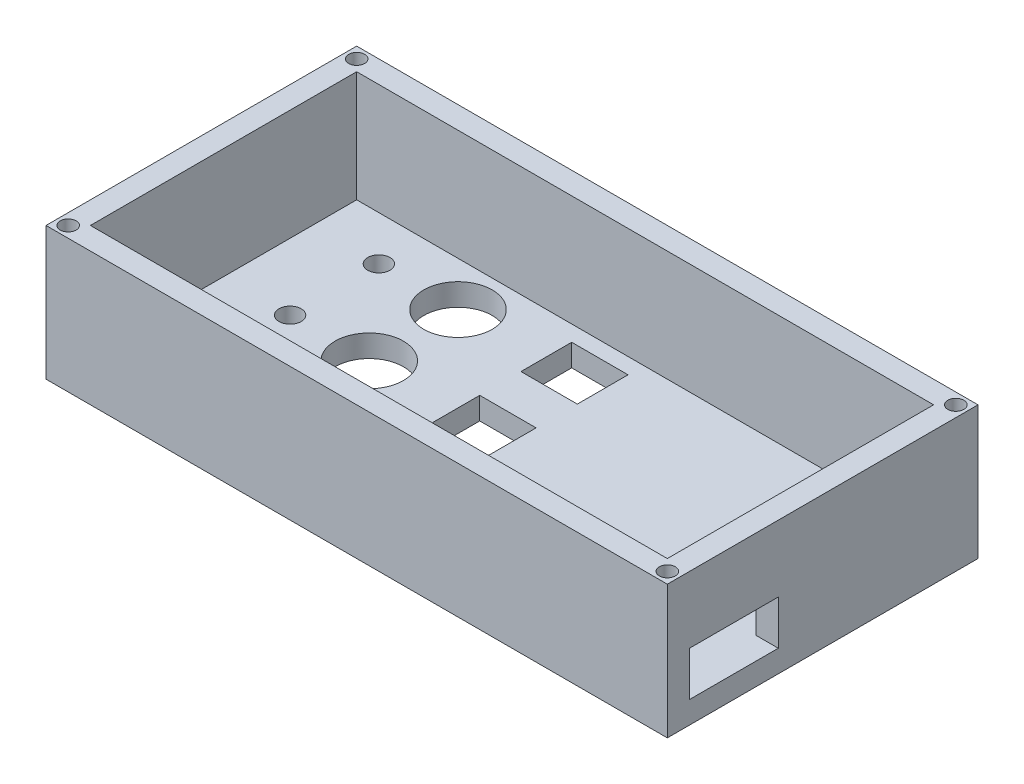
from build123d import *

# Parameters (mm, degrees)
SKETCH1_W                = 140
SKETCH1_H                = 70
BOSS_EXTRUDE1_DEPTH      = 30
SKETCH2_W                = 130
SKETCH2_H                = 60
CUT_EXTRUDE1_DEPTH       = 25
SKETCH3_W                = 5
SKETCH3_H                = 5.715
CUT_EXTRUDE2_DEPTH       = 25
SKETCH4_W                = 20
SKETCH4_H                = 10
CUT_EXTRUDE6_DEPTH       = 25
M3_CLEARANCE_HOLE1_D     = 3.6
M3_CLEARANCE_HOLE1_DEPTH = 5
M3_CLEARANCE_HOLE1_TIP   = 1.081549114


with BuildPart() as part:
    # Sketch1 → Boss-Extrude1 (new body)
    with BuildSketch(Plane(origin=(0, 0, 0), x_dir=(1, 0, 0), z_dir=(0, 1, 0))):
        with Locations((70, 35)):
            Rectangle(SKETCH1_W, SKETCH1_H)
    extrude(amount=BOSS_EXTRUDE1_DEPTH)

    # Sketch2 → Cut-Extrude1 (cut)
    with BuildSketch(Plane(origin=(0, 30, 0), x_dir=(1, 0, 0), z_dir=(0, 1, 0))):
        with Locations((70, 35)):
            Rectangle(SKETCH2_W, SKETCH2_H)
    extrude(amount=-CUT_EXTRUDE1_DEPTH, mode=Mode.SUBTRACT)

    # Sketch3 → Cut-Extrude2 (cut)
    with BuildSketch(Plane.XZ):
        with BuildLine():
            ThreePointArc((22.5, -15), (21.767766953, -13.232233047), (20, -12.5))
            Line((20, -12.5), (20, -15))
            Line((20, -15), (20, -17.5))
            ThreePointArc((20, -17.5), (21.767766953, -16.767766953), (22.5, -15))
        make_face()
        with BuildLine():
            ThreePointArc((45.533822472, -15), (32.389100257, -9.555277785), (37.833822472, -22.7))
            ThreePointArc((37.833822472, -22.7), (43.278544687, -20.444722215), (45.533822472, -15))
        make_face()
        Polygon((57.017644944, -20), (62.017644944, -20), (69.717644944, -20), (69.717644944, -8.57), (57.017644944, -8.57), (57.017644944, -15), align=None)
        Polygon((69.717644944, -50), (62.017644944, -50), (57.017644944, -50), (57.017644944, -61.43), (69.717644944, -61.43), align=None)
        with Locations((59.517644944, -32.1425)):
            Rectangle(SKETCH3_W, SKETCH3_H)
        with Locations((59.517644944, -37.8575)):
            Rectangle(SKETCH3_W, SKETCH3_H)
        with BuildLine():
            ThreePointArc((45.533822472, -55), (43.278544687, -49.555277785), (37.833822472, -47.3))
            ThreePointArc((37.833822472, -47.3), (32.389100257, -60.444722215), (45.533822472, -55))
        make_face()
        with BuildLine():
            ThreePointArc((37.833822472, -27.3), (32.389100257, -29.555277785), (30.133822472, -35))
            Line((30.133822472, -35), (37.833822472, -35))
            Line((37.833822472, -35), (37.833822472, -27.3))
        make_face()
        with BuildLine():
            Line((37.833822472, -35), (30.133822472, -35))
            ThreePointArc((30.133822472, -35), (32.389100257, -40.444722215), (37.833822472, -42.7))
            Line((37.833822472, -42.7), (37.833822472, -35))
        make_face()
        with BuildLine():
            ThreePointArc((22.5, -55), (21.767766953, -53.232233047), (20, -52.5))
            Line((20, -52.5), (20, -57.5))
            ThreePointArc((20, -57.5), (21.767766953, -56.767766953), (22.5, -55))
        make_face()
        with BuildLine():
            Line((20, -57.5), (20, -52.5))
            ThreePointArc((20, -52.5), (17.5, -55), (20, -57.5))
        make_face()
        with BuildLine():
            ThreePointArc((22.5, -35), (21.767766953, -33.232233047), (20, -32.5))
            Line((20, -32.5), (20, -35))
            Line((20, -35), (22.5, -35))
        make_face()
        with BuildLine():
            Line((20, -35), (20, -32.5))
            ThreePointArc((20, -32.5), (17.5, -35), (20, -37.5))
            Line((20, -37.5), (20, -35))
        make_face()
        with BuildLine():
            Line((20, -15), (20, -12.5))
            ThreePointArc((20, -12.5), (17.5, -15), (20, -17.5))
            Line((20, -17.5), (20, -15))
        make_face()
        with BuildLine():
            Line((22.5, -35), (20, -35))
            Line((20, -35), (20, -37.5))
            ThreePointArc((20, -37.5), (21.767766953, -36.767766953), (22.5, -35))
        make_face()
        with BuildLine():
            Line((37.833822472, -27.3), (37.833822472, -35))
            Line((37.833822472, -35), (45.533822472, -35))
            ThreePointArc((45.533822472, -35), (43.278544687, -29.555277785), (37.833822472, -27.3))
        make_face()
        with BuildLine():
            Line((45.533822472, -35), (37.833822472, -35))
            Line((37.833822472, -35), (37.833822472, -42.7))
            ThreePointArc((37.833822472, -42.7), (43.278544687, -40.444722215), (45.533822472, -35))
        make_face()
        Polygon((62.017644944, -29.285), (62.017644944, -35), (62.017644944, -40.715), (68.367644944, -40.715), (69.717644944, -40.715), (69.717644944, -29.285), (68.367644944, -29.285), align=None)
    extrude(amount=-CUT_EXTRUDE2_DEPTH, mode=Mode.SUBTRACT)

    # Sketch4 → Cut-Extrude6 (cut)
    with BuildSketch(Plane(origin=(140, 0, 0), x_dir=(0, 0, -1), z_dir=(1, 0, 0))):
        with Locations((15, 10)):
            Rectangle(SKETCH4_W, SKETCH4_H)
    extrude(amount=-CUT_EXTRUDE6_DEPTH, mode=Mode.SUBTRACT)

    # M3 Clearance Hole1
    with Locations(Plane(origin=(0, 30, 0), x_dir=(1, 0, 0), z_dir=(0, 1, 0))):
        with Locations((2.5, 2.5), (2.5, 67.5), (137.5, 67.5), (137.5, 2.5)):
            Hole(M3_CLEARANCE_HOLE1_D / 2, depth=M3_CLEARANCE_HOLE1_DEPTH)
            with Locations((0, 0, -(M3_CLEARANCE_HOLE1_DEPTH + M3_CLEARANCE_HOLE1_TIP / 2))):  # 118° drill point
                Cone(0, M3_CLEARANCE_HOLE1_D / 2, M3_CLEARANCE_HOLE1_TIP, mode=Mode.SUBTRACT)


solid = part.part
